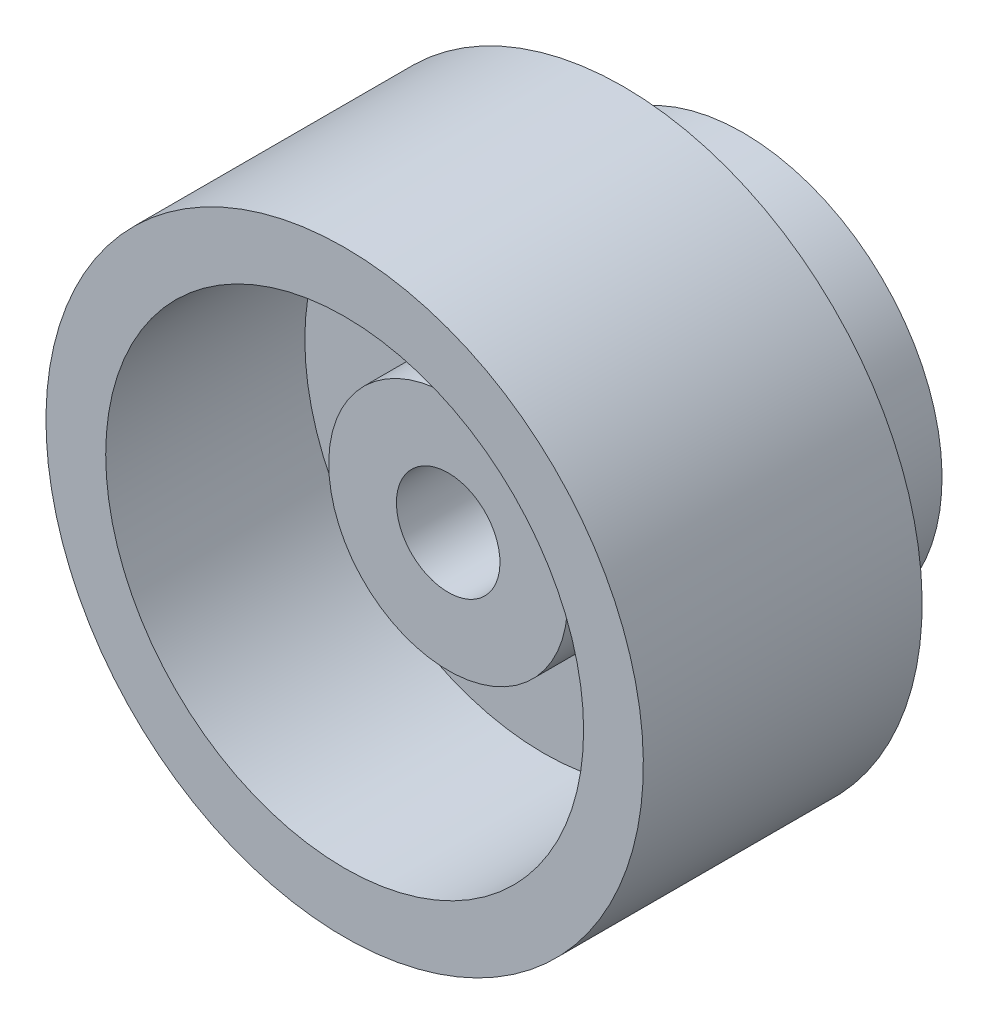
from build123d import *


with BuildPart() as part:
    # Sketch2 → Revolve1 (revolve)
    with BuildSketch(Plane(origin=(0, 0, 0), x_dir=(0, 0, -1), z_dir=(1, 0, 0))):
        Polygon((-12, 6.5), (-12, 15), (0, 15), (0, 30), (-25, 30), (-25, 37.5), (10, 37.5), (10, 25), (25, 25), (25, 6.5), align=None)
    revolve(axis=Axis((0, 0, -25), (0, 0, 1)))


solid = part.part
